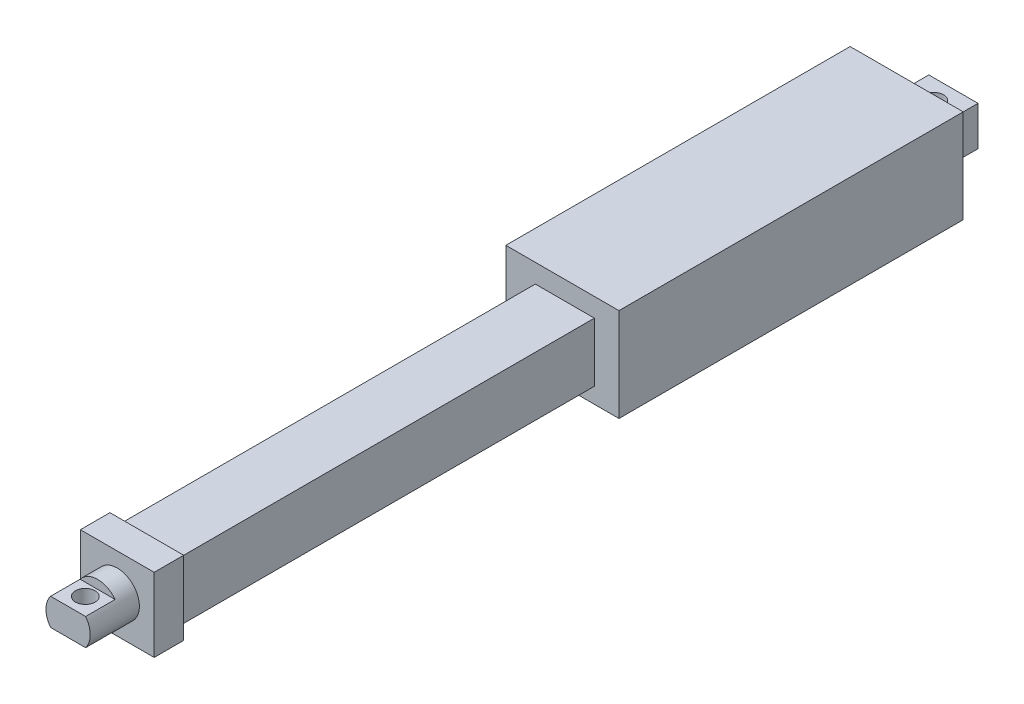
from build123d import *

# Parameters (mm, degrees)
SKETCH2_W           = 23
SKETCH2_H           = 19
BOSS_EXTRUDE1_DEPTH = 70
SKETCH3_W           = 10
SKETCH3_H           = 8
BOSS_EXTRUDE2_DEPTH = 9
SKETCH4_R           = 2
CUT_EXTRUDE1_DEPTH  = 73.156975517
SKETCH5_W           = 12
SKETCH5_H           = 12
BOSS_EXTRUDE3_DEPTH = 85
SKETCH6_W           = 15
SKETCH6_H           = 15
BOSS_EXTRUDE4_DEPTH = 6
BOSS_EXTRUDE5_DEPTH = 10
CUT_EXTRUDE2_START  = -6
CUT_EXTRUDE2_DEPTH  = 6
SKETCH9_R           = 2
CUT_EXTRUDE3_DEPTH  = 172.816281943


with BuildPart() as part:
    # Sketch2 → Boss-Extrude1 (new body)
    with BuildSketch(Plane.XY):
        with Locations((-0.231543624, 1.473154362)):
            Rectangle(SKETCH2_W, SKETCH2_H)
    extrude(amount=BOSS_EXTRUDE1_DEPTH)

    # Sketch3 → Boss-Extrude2 (add)
    with BuildSketch(Plane(origin=(0, 0, 0), x_dir=(-1, 0, 0), z_dir=(0, 0, -1))):
        with Locations((-0.268456376, 0.973154362)):
            Rectangle(SKETCH3_W, SKETCH3_H)
    extrude(amount=BOSS_EXTRUDE2_DEPTH)

    # Sketch4 → Cut-Extrude1 (cut, through all)
    with BuildSketch(Plane(origin=(0, 4.973154362, 0), x_dir=(1, 0, 0), z_dir=(0, 1, 0))):
        with Locations(Location((0.268456376, 5, 0), (0, 0, 180))):
            Circle(SKETCH4_R)
    extrude(amount=-CUT_EXTRUDE1_DEPTH, mode=Mode.SUBTRACT)

    # Sketch5 → Boss-Extrude3 (add)
    with BuildSketch(Plane.XY.offset(70)):
        with Locations((0.268456376, 1.148154362)):
            Rectangle(SKETCH5_W, SKETCH5_H)
    extrude(amount=BOSS_EXTRUDE3_DEPTH)

    # Sketch6 → Boss-Extrude4 (add)
    with BuildSketch(Plane.XY.offset(155)):
        with Locations((0.268456376, 1.148154362)):
            Rectangle(SKETCH6_W, SKETCH6_H)
    extrude(amount=BOSS_EXTRUDE4_DEPTH)

    # Sketch7 → Boss-Extrude5 (add)
    with BuildSketch(Plane.XY.offset(161)):
        with BuildLine():
            ThreePointArc((-4.231543624, 1.148154362), (-2.91352414, -2.033826153), (0.268456376, -3.351845638))
            Line((0.268456376, -3.351845638), (0.268456376, 1.148154362))
            Line((0.268456376, 1.148154362), (-4.231543624, 1.148154362))
        make_face()
        with BuildLine():
            Line((0.268456376, 1.148154362), (0.268456376, -3.351845638))
            ThreePointArc((0.268456376, -3.351845638), (3.450436891, -2.033826153), (4.768456376, 1.148154362))
            Line((4.768456376, 1.148154362), (0.268456376, 1.148154362))
        make_face()
        with BuildLine():
            Line((-4.231543624, 1.148154362), (0.268456376, 1.148154362))
            Line((0.268456376, 1.148154362), (0.268456376, 5.648154362))
            ThreePointArc((0.268456376, 5.648154362), (-2.91352414, 4.330134878), (-4.231543624, 1.148154362))
        make_face()
        with BuildLine():
            Line((0.268456376, 5.648154362), (0.268456376, 1.148154362))
            Line((0.268456376, 1.148154362), (4.768456376, 1.148154362))
            ThreePointArc((4.768456376, 1.148154362), (3.450436891, 4.330134878), (0.268456376, 5.648154362))
        make_face()
        with BuildLine():
            ThreePointArc((-4.231543624, 1.148154362), (-2.91352414, -2.033826153), (0.268456376, -3.351845638))
            Line((0.268456376, -3.351845638), (0.268456376, 1.148154362))
            Line((0.268456376, 1.148154362), (-4.231543624, 1.148154362))
        make_face()
        with BuildLine():
            Line((0.268456376, 1.148154362), (0.268456376, -3.351845638))
            ThreePointArc((0.268456376, -3.351845638), (3.450436891, -2.033826153), (4.768456376, 1.148154362))
            Line((4.768456376, 1.148154362), (0.268456376, 1.148154362))
        make_face()
        with BuildLine():
            Line((-4.231543624, 1.148154362), (0.268456376, 1.148154362))
            Line((0.268456376, 1.148154362), (0.268456376, 5.648154362))
            ThreePointArc((0.268456376, 5.648154362), (-2.91352414, 4.330134878), (-4.231543624, 1.148154362))
        make_face()
        with BuildLine():
            Line((0.268456376, 5.648154362), (0.268456376, 1.148154362))
            Line((0.268456376, 1.148154362), (4.768456376, 1.148154362))
            ThreePointArc((4.768456376, 1.148154362), (3.450436891, 4.330134878), (0.268456376, 5.648154362))
        make_face()
        with BuildLine():
            ThreePointArc((-4.231543624, 1.148154362), (-2.91352414, -2.033826153), (0.268456376, -3.351845638))
            Line((0.268456376, -3.351845638), (0.268456376, 1.148154362))
            Line((0.268456376, 1.148154362), (-4.231543624, 1.148154362))
        make_face()
        with BuildLine():
            Line((0.268456376, 1.148154362), (0.268456376, -3.351845638))
            ThreePointArc((0.268456376, -3.351845638), (3.450436891, -2.033826153), (4.768456376, 1.148154362))
            Line((4.768456376, 1.148154362), (0.268456376, 1.148154362))
        make_face()
        with BuildLine():
            Line((-4.231543624, 1.148154362), (0.268456376, 1.148154362))
            Line((0.268456376, 1.148154362), (0.268456376, 5.648154362))
            ThreePointArc((0.268456376, 5.648154362), (-2.91352414, 4.330134878), (-4.231543624, 1.148154362))
        make_face()
        with BuildLine():
            Line((0.268456376, 5.648154362), (0.268456376, 1.148154362))
            Line((0.268456376, 1.148154362), (4.768456376, 1.148154362))
            ThreePointArc((4.768456376, 1.148154362), (3.450436891, 4.330134878), (0.268456376, 5.648154362))
        make_face()
        with BuildLine():
            ThreePointArc((-4.231543624, 1.148154362), (-2.91352414, -2.033826153), (0.268456376, -3.351845638))
            Line((0.268456376, -3.351845638), (0.268456376, 1.148154362))
            Line((0.268456376, 1.148154362), (-4.231543624, 1.148154362))
        make_face()
        with BuildLine():
            Line((0.268456376, 1.148154362), (0.268456376, -3.351845638))
            ThreePointArc((0.268456376, -3.351845638), (3.450436891, -2.033826153), (4.768456376, 1.148154362))
            Line((4.768456376, 1.148154362), (0.268456376, 1.148154362))
        make_face()
        with BuildLine():
            Line((-4.231543624, 1.148154362), (0.268456376, 1.148154362))
            Line((0.268456376, 1.148154362), (0.268456376, 5.648154362))
            ThreePointArc((0.268456376, 5.648154362), (-2.91352414, 4.330134878), (-4.231543624, 1.148154362))
        make_face()
        with BuildLine():
            Line((0.268456376, 5.648154362), (0.268456376, 1.148154362))
            Line((0.268456376, 1.148154362), (4.768456376, 1.148154362))
            ThreePointArc((4.768456376, 1.148154362), (3.450436891, 4.330134878), (0.268456376, 5.648154362))
        make_face()
    extrude(amount=BOSS_EXTRUDE5_DEPTH)

    # Sketch8 → Cut-Extrude2 (cut)
    with BuildSketch(Plane.XY.offset(171).offset(CUT_EXTRUDE2_START)):
        with BuildLine():
            Line((-3.293495336, 3.898154362), (0.268456376, 3.898154362))
            Line((0.268456376, 3.898154362), (0.268456376, 5.648154362))
            ThreePointArc((0.268456376, 5.648154362), (-1.715857107, 5.187027968), (-3.293495336, 3.898154362))
        make_face()
        with BuildLine():
            Line((0.268456376, 5.648154362), (0.268456376, 3.898154362))
            Line((0.268456376, 3.898154362), (3.830408088, 3.898154362))
            ThreePointArc((3.830408088, 3.898154362), (2.252769859, 5.187027968), (0.268456376, 5.648154362))
        make_face()
        with BuildLine():
            Line((-3.293495336, 3.898154362), (0.268456376, 3.898154362))
            Line((0.268456376, 3.898154362), (0.268456376, 5.648154362))
            ThreePointArc((0.268456376, 5.648154362), (-1.715857107, 5.187027968), (-3.293495336, 3.898154362))
        make_face()
        with BuildLine():
            Line((0.268456376, 5.648154362), (0.268456376, 3.898154362))
            Line((0.268456376, 3.898154362), (3.830408088, 3.898154362))
            ThreePointArc((3.830408088, 3.898154362), (2.252769859, 5.187027968), (0.268456376, 5.648154362))
        make_face()
        with BuildLine():
            ThreePointArc((-3.293495336, -1.601845638), (-1.715857107, -2.890719243), (0.268456376, -3.351845638))
            Line((0.268456376, -3.351845638), (0.268456376, -1.601845638))
            Line((0.268456376, -1.601845638), (-3.293495336, -1.601845638))
        make_face()
        with BuildLine():
            Line((0.268456376, -1.601845638), (0.268456376, -3.351845638))
            ThreePointArc((0.268456376, -3.351845638), (2.252769859, -2.890719243), (3.830408088, -1.601845638))
            Line((3.830408088, -1.601845638), (0.268456376, -1.601845638))
        make_face()
        with BuildLine():
            ThreePointArc((-3.293495336, -1.601845638), (-1.715857107, -2.890719243), (0.268456376, -3.351845638))
            Line((0.268456376, -3.351845638), (0.268456376, -1.601845638))
            Line((0.268456376, -1.601845638), (-3.293495336, -1.601845638))
        make_face()
        with BuildLine():
            Line((0.268456376, -1.601845638), (0.268456376, -3.351845638))
            ThreePointArc((0.268456376, -3.351845638), (2.252769859, -2.890719243), (3.830408088, -1.601845638))
            Line((3.830408088, -1.601845638), (0.268456376, -1.601845638))
        make_face()
    extrude(amount=CUT_EXTRUDE2_DEPTH, mode=Mode.SUBTRACT)

    # Sketch9 → Cut-Extrude3 (cut, through all)
    with BuildSketch(Plane(origin=(0, 3.898154362, 0), x_dir=(1, 0, 0), z_dir=(0, 1, 0))):
        with Locations(Location((0.266504664, -167.5, 0), (0, 0, 180))):
            Circle(SKETCH9_R)
    extrude(amount=-CUT_EXTRUDE3_DEPTH, mode=Mode.SUBTRACT)


solid = part.part
